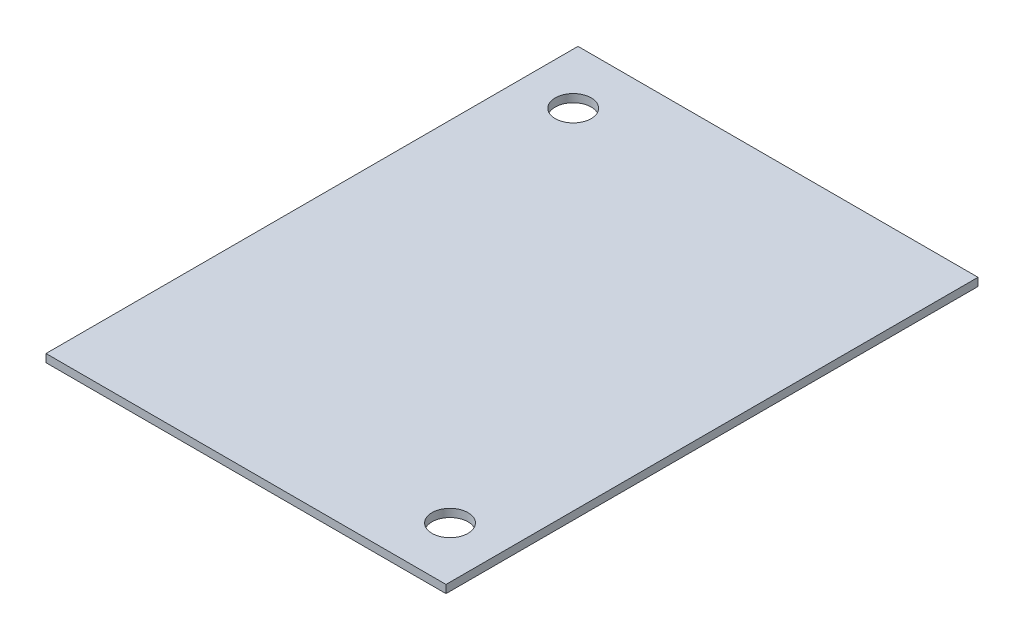
from build123d import *

# Parameters (mm, degrees)
SKETCH1_W           = 50
SKETCH1_H           = 66.5
SKETCH1_R           = 2.25
BOSS_EXTRUDE1_DEPTH = 1


with BuildPart() as part:
    # Sketch1 → Boss-Extrude1 (new body)
    with BuildSketch(Plane(origin=(0, 0, 0), x_dir=(1, 0, 0), z_dir=(0, 1, 0))):
        Rectangle(SKETCH1_W, SKETCH1_H)
        with Locations(Location((-18.6, 26.25, 0), (0, 0, 270))):
            Circle(SKETCH1_R, mode=Mode.SUBTRACT)
        with Locations(Location((18.6, -26.35, 0), (0, 0, 270))):
            Circle(SKETCH1_R, mode=Mode.SUBTRACT)
    extrude(amount=BOSS_EXTRUDE1_DEPTH)


solid = part.part
